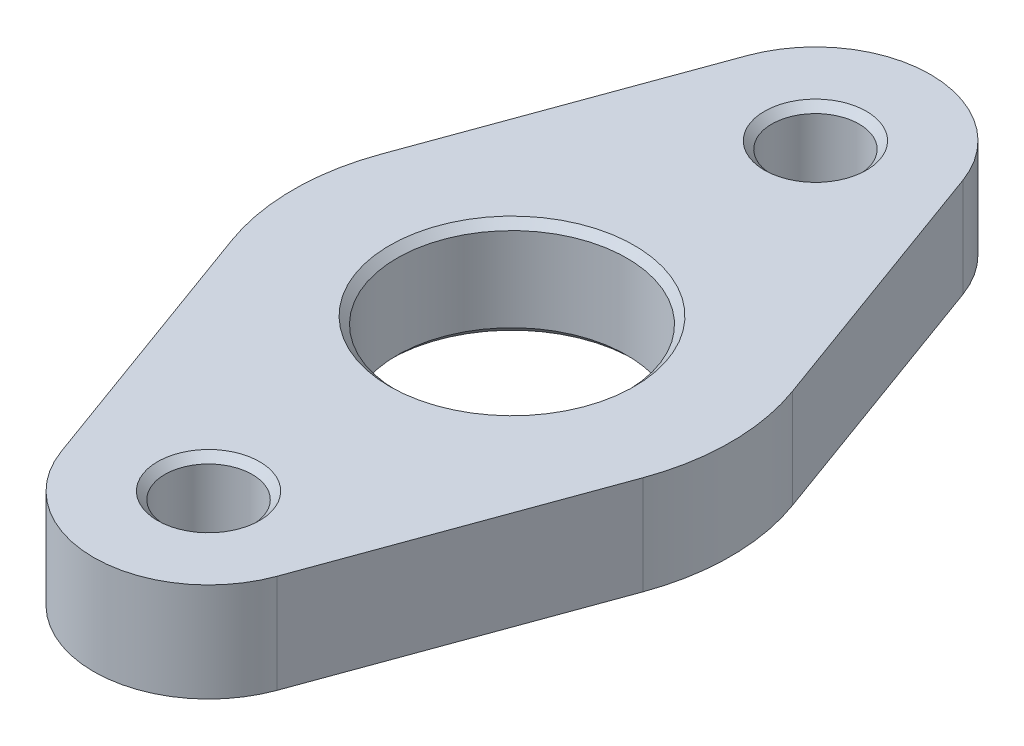
from build123d import *
from build123d.topology import SkipClean

# Parameters (mm, degrees)
BOSS_EXTRUDE1_START     = 16.51
SKETCH2_R               = 6.6675
SKETCH2_R_2             = 47.625
SKETCH2_R_3             = 25.4
BOSS_EXTRUDE1_DEPTH     = 16.51
CUT_EXTRUDE1_REACH      = 129.898
SKETCH3_R               = 9.525
CHAMFER1_SIZE           = 0.8128
CHAMFER2_SIZE           = 0.8128
CHAMFER3_SIZE           = 3.175
FILLET2_R               = 1.524
SKETCH4_R               = 7.4803
SKETCH4_R_2             = 25.4
BOSS_EXTRUDE2_DEPTH     = 16.51
SKETCH6_R               = 76.2
SKETCH6_R_2             = 9.525
SKETCH6_R_3             = 25.4
BOSS_EXTRUDE3_DEPTH     = 16.51
SKETCH8_R               = 12.7
SKETCH8_R_2             = 4.826
BOSS_EXTRUDE4_DEPTH     = 9.8552
BOSS_EXTRUDE5_REACH     = 241.142
SKETCH9_R               = 19.05
CUT_EXTRUDE2_REACH      = 241.142
CUT_EXTRUDE2_END_RADIUS = 25.4
SKETCH8_4_R             = 12.7
CHAMFER4_SIZE           = 0.8128
CHAMFER5_SIZE           = 3.175
FILLET3_R               = 2.032
SKETCH10_R              = 4.826
SKETCH10_R_2            = 12.7
BOSS_EXTRUDE6_DEPTH     = 10.922
CHAMFER6_SIZE           = 0.8128


with BuildPart() as part:
    # Sketch1 → Revolve1 (revolve)
    with BuildSketch(Plane.XY, mode=Mode.PRIVATE) as revolve1_sk:
        Polygon((0, 25.4), (53.975, 25.4), (53.975, 47.625), (52.3748, 46.0248), (52.3748, 34.29), (34.925, 34.29), (16.51, 38.204229083), (16.51, 76.2), (1.6002, 76.2), (1.6002, 47.6377), (0, 46.0375), align=None)
    revolve(revolve1_sk.sketch.rotate(Axis((0, 0, 0), (1, 0, 0)), 90), axis=Axis((0, 0, 0), (1, 0, 0)))

    # Sketch2 → Boss-Extrude1 (add)
    # profile 1 of 2: a face of its own
    with BuildSketch(Plane(origin=(53.975, 0, 0), x_dir=(0, 0, -1), z_dir=(1, 0, 0)).offset(BOSS_EXTRUDE1_START)):
        with BuildLine():
            Line((-59.9948, 40.005), (-59.9948, 24.717162721))
            ThreePointArc((-59.9948, 24.717162721), (-60.246417717, 21.150810443), (-60.996285714, 17.655116229))
            ThreePointArc((-60.996285714, 17.655116229), (-63.5, 0), (-60.996285714, -17.655116229))
            ThreePointArc((-60.996285714, -17.655116229), (-60.246417717, -21.150810443), (-59.9948, -24.717162721))
            Line((-59.9948, -24.717162721), (-59.9948, -40.005))
            ThreePointArc((-59.9948, -40.005), (-54.139923135, -54.139923135), (-40.005, -59.9948))
            Line((-40.005, -59.9948), (-24.717162721, -59.9948))
            ThreePointArc((-24.717162721, -59.9948), (-21.150810443, -60.246417717), (-17.655116229, -60.996285714))
            ThreePointArc((-17.655116229, -60.996285714), (0, -63.5), (17.655116229, -60.996285714))
            ThreePointArc((17.655116229, -60.996285714), (21.150810443, -60.246417717), (24.717162721, -59.9948))
            Line((24.717162721, -59.9948), (40.005, -59.9948))
            ThreePointArc((40.005, -59.9948), (54.139923135, -54.139923135), (59.9948, -40.005))
            Line((59.9948, -40.005), (59.9948, -24.717162721))
            ThreePointArc((59.9948, -24.717162721), (60.246417717, -21.150810443), (60.996285714, -17.655116229))
            ThreePointArc((60.996285714, -17.655116229), (63.5, 0), (60.996285714, 17.655116229))
            ThreePointArc((60.996285714, 17.655116229), (60.246417717, 21.150810443), (59.9948, 24.717162721))
            Line((59.9948, 24.717162721), (59.9948, 40.005))
            ThreePointArc((59.9948, 40.005), (54.139923135, 54.139923135), (40.005, 59.9948))
            Line((40.005, 59.9948), (24.717162721, 59.9948))
            ThreePointArc((24.717162721, 59.9948), (21.150810443, 60.246417717), (17.655116229, 60.996285714))
            ThreePointArc((17.655116229, 60.996285714), (0, 63.5), (-17.655116229, 60.996285714))
            ThreePointArc((-17.655116229, 60.996285714), (-21.150810443, 60.246417717), (-24.717162721, 59.9948))
            Line((-24.717162721, 59.9948), (-40.005, 59.9948))
            ThreePointArc((-40.005, 59.9948), (-54.139923135, 54.139923135), (-59.9948, 40.005))
        make_face()
        with Locations((-42.656216575, -42.656216575)):
            Circle(SKETCH2_R, mode=Mode.SUBTRACT)
        with Locations((42.656216575, -42.656216575)):
            Circle(SKETCH2_R, mode=Mode.SUBTRACT)
        with Locations((42.656216575, 42.656216575)):
            Circle(SKETCH2_R, mode=Mode.SUBTRACT)
        with Locations((-42.656216575, 42.656216575)):
            Circle(SKETCH2_R, mode=Mode.SUBTRACT)
        Circle(SKETCH2_R_2, mode=Mode.SUBTRACT)
    # profile 2 of 2: a face of its own
    with BuildSketch(Plane(origin=(53.975, 0, 0), x_dir=(0, 0, -1), z_dir=(1, 0, 0)).offset(BOSS_EXTRUDE1_START)):
        Circle(SKETCH2_R_2)
        with Locations(Location((0, 0, 0), (0, 0, 180))):
            Circle(SKETCH2_R_3, mode=Mode.SUBTRACT)
    extrude(amount=-BOSS_EXTRUDE1_DEPTH)

    # Sketch3 → Cut-Extrude1 (cut, up to next)
    with BuildSketch(Plane.ZY.offset(-1.6002), mode=Mode.PRIVATE) as cut_extrude1_sk1:
        with Locations((-42.656216575, 42.656216575)):
            Circle(SKETCH3_R)
    cut_extrude1_tool1 = extrude(cut_extrude1_sk1.sketch, amount=-CUT_EXTRUDE1_REACH, mode=Mode.PRIVATE) & part.part
    # Sketch3 → Cut-Extrude1 (cut, up to next)
    with BuildSketch(Plane.ZY.offset(-1.6002), mode=Mode.PRIVATE) as cut_extrude1_sk2:
        with Locations((42.656216575, 42.656216575)):
            Circle(SKETCH3_R)
    cut_extrude1_tool2 = extrude(cut_extrude1_sk2.sketch, amount=-CUT_EXTRUDE1_REACH, mode=Mode.PRIVATE) & part.part
    # Sketch3 → Cut-Extrude1 (cut, up to next)
    with BuildSketch(Plane.ZY.offset(-1.6002), mode=Mode.PRIVATE) as cut_extrude1_sk3:
        with Locations((42.656216575, -42.656216575)):
            Circle(SKETCH3_R)
    cut_extrude1_tool3 = extrude(cut_extrude1_sk3.sketch, amount=-CUT_EXTRUDE1_REACH, mode=Mode.PRIVATE) & part.part
    # Sketch3 → Cut-Extrude1 (cut, up to next)
    with BuildSketch(Plane.ZY.offset(-1.6002), mode=Mode.PRIVATE) as cut_extrude1_sk4:
        with Locations((-42.656216575, -42.656216575)):
            Circle(SKETCH3_R)
    cut_extrude1_tool4 = extrude(cut_extrude1_sk4.sketch, amount=-CUT_EXTRUDE1_REACH, mode=Mode.PRIVATE) & part.part
    add(cut_extrude1_tool1.solids().sort_by_distance((1.6002, 42.656217, -42.656217))[0], mode=Mode.SUBTRACT)
    add(cut_extrude1_tool2.solids().sort_by_distance((1.6002, 42.656217, 42.656217))[0], mode=Mode.SUBTRACT)
    add(cut_extrude1_tool3.solids().sort_by_distance((1.6002, -42.656217, 42.656217))[0], mode=Mode.SUBTRACT)
    add(cut_extrude1_tool4.solids().sort_by_distance((1.6002, -42.656217, -42.656217))[0], mode=Mode.SUBTRACT)

    # Chamfer1
    chamfer1_edges = [part.edges().sort_by_distance(p)[0] for p in [
        (70.485, 42.656216575, 49.323716575),
        (70.485, 42.656216575, -35.988716575),
        (70.485, -42.656216575, -35.988716575),
        (70.485, -42.656216575, 49.323716575),
        (53.975, -42.656216575, 49.323716575),
        (53.975, -42.656216575, -35.988716575),
        (53.975, 42.656216575, -35.988716575),
        (53.975, 42.656216575, 49.323716575),
    ]]
    chamfer(chamfer1_edges, length=CHAMFER1_SIZE)

    # Chamfer2
    chamfer2_edges = [part.edges().sort_by_distance(p)[0] for p in [
        (1.6002, -42.656216575, 33.131216575),
        (16.51, -42.656216575, 33.131216575),
        (1.6002, 42.656216575, 33.131216575),
        (16.51, 42.656216575, 33.131216575),
        (1.6002, 42.656216575, -52.181216575),
        (16.51, 42.656216575, -52.181216575),
        (1.6002, -42.656216575, -52.181216575),
        (16.51, -42.656216575, -52.181216575),
    ]]
    chamfer(chamfer2_edges, length=CHAMFER2_SIZE)

    # Chamfer3
    chamfer3_edges = [part.edges().sort_by_distance(p)[0] for p in [
        (0, 0, -25.4),
        (70.485, 0, -25.4),
    ]]
    chamfer(chamfer3_edges, length=CHAMFER3_SIZE)

    # Fillet2
    fillet2_edges = [part.edges().sort_by_distance(p)[0] for p in [
        (16.51, 0, -38.204229083),
        (52.3748, 0, -34.29),
    ]]
    fillet(fillet2_edges, radius=FILLET2_R)


with BuildPart() as body_2:
    # Sketch4 → Boss-Extrude2 (new body)
    with BuildSketch(Plane(origin=(70.485, 0, 0), x_dir=(0, 0, -1), z_dir=(1, 0, 0))):
        with BuildLine():
            Line((-59.9948, 40.005), (-59.9948, 24.717162721))
            ThreePointArc((-59.9948, 24.717162721), (-60.246417717, 21.150810443), (-60.996285714, 17.655116229))
            ThreePointArc((-60.996285714, 17.655116229), (-63.5, 0), (-60.996285714, -17.655116229))
            ThreePointArc((-60.996285714, -17.655116229), (-60.246417717, -21.150810443), (-59.9948, -24.717162721))
            Line((-59.9948, -24.717162721), (-59.9948, -40.005))
            ThreePointArc((-59.9948, -40.005), (-54.139923135, -54.139923135), (-40.005, -59.9948))
            Line((-40.005, -59.9948), (-24.717162721, -59.9948))
            ThreePointArc((-24.717162721, -59.9948), (-21.150810443, -60.246417717), (-17.655116229, -60.996285714))
            ThreePointArc((-17.655116229, -60.996285714), (0, -63.5), (17.655116229, -60.996285714))
            ThreePointArc((17.655116229, -60.996285714), (21.150810443, -60.246417717), (24.717162721, -59.9948))
            Line((24.717162721, -59.9948), (40.005, -59.9948))
            ThreePointArc((40.005, -59.9948), (54.139923135, -54.139923135), (59.9948, -40.005))
            Line((59.9948, -40.005), (59.9948, -24.717162721))
            ThreePointArc((59.9948, -24.717162721), (60.246417717, -21.150810443), (60.996285714, -17.655116229))
            ThreePointArc((60.996285714, -17.655116229), (63.5, 0), (60.996285714, 17.655116229))
            ThreePointArc((60.996285714, 17.655116229), (60.246417717, 21.150810443), (59.9948, 24.717162721))
            Line((59.9948, 24.717162721), (59.9948, 40.005))
            ThreePointArc((59.9948, 40.005), (54.139923135, 54.139923135), (40.005, 59.9948))
            Line((40.005, 59.9948), (24.717162721, 59.9948))
            ThreePointArc((24.717162721, 59.9948), (21.150810443, 60.246417717), (17.655116229, 60.996285714))
            ThreePointArc((17.655116229, 60.996285714), (0, 63.5), (-17.655116229, 60.996285714))
            ThreePointArc((-17.655116229, 60.996285714), (-21.150810443, 60.246417717), (-24.717162721, 59.9948))
            Line((-24.717162721, 59.9948), (-40.005, 59.9948))
            ThreePointArc((-40.005, 59.9948), (-54.139923135, 54.139923135), (-59.9948, 40.005))
        make_face()
        with Locations((42.656216575, -42.656216575)):
            Circle(SKETCH4_R, mode=Mode.SUBTRACT)
        with Locations((42.656216575, 42.656216575)):
            Circle(SKETCH4_R, mode=Mode.SUBTRACT)
        with Locations((-42.656216575, 42.656216575)):
            Circle(SKETCH4_R, mode=Mode.SUBTRACT)
        with Locations((-42.656216575, -42.656216575)):
            Circle(SKETCH4_R, mode=Mode.SUBTRACT)
        Circle(SKETCH4_R_2, mode=Mode.SUBTRACT)
    extrude(amount=BOSS_EXTRUDE2_DEPTH)

    # Sketch5 → Revolve2 (revolve)
    with BuildSketch(Plane.XY, mode=Mode.PRIVATE) as revolve2_sk:
        with BuildLine():
            Line((86.995, -25.4), (156.845, -25.4))
            Line((156.845, -25.4), (156.845, -38.1))
            Line((156.845, -38.1), (141.097, -38.1))
            Line((141.097, -38.1), (100.143007491, -49.07358922))
            ThreePointArc((100.143007491, -49.07358922), (93.625730565, -50.369956202), (86.995, -50.804557244))
            Line((86.995, -50.804557244), (86.995, -25.4))
        make_face()
    revolve(revolve2_sk.sketch.rotate(Axis((0, 0, 0), (1, 0, 0)), 270), axis=Axis((0, 0, 0), (1, 0, 0)))

    # Sketch6 → Boss-Extrude3 (add)
    with BuildSketch(Plane(origin=(156.845, 0, 0), x_dir=(0, 0, -1), z_dir=(1, 0, 0))):
        Circle(SKETCH6_R)
        with Locations((-42.656216575, 42.656216575)):
            Circle(SKETCH6_R_2, mode=Mode.SUBTRACT)
        with Locations((-42.656216575, -42.656216575)):
            Circle(SKETCH6_R_2, mode=Mode.SUBTRACT)
        with Locations((42.656216575, 42.656216575)):
            Circle(SKETCH6_R_2, mode=Mode.SUBTRACT)
        with Locations((42.656216575, -42.656216575)):
            Circle(SKETCH6_R_2, mode=Mode.SUBTRACT)
        Circle(SKETCH6_R_3, mode=Mode.SUBTRACT)
    extrude(amount=BOSS_EXTRUDE3_DEPTH)

    # Sketch8 → Boss-Extrude4 (add)
    # profile 1 of 4: a face of its own
    with BuildSketch(Plane(origin=(0, 69.85, 0), x_dir=(1, 0, 0), z_dir=(0, 1, 0))):
        with Locations((95.885, 33.528)):
            Circle(SKETCH8_R)
        with Locations(Location((95.885, 33.528, 0), (0, 0, 270))):
            Circle(SKETCH8_R_2, mode=Mode.SUBTRACT)
    # profile 2 of 4: a face of its own
    with BuildSketch(Plane(origin=(0, 69.85, 0), x_dir=(1, 0, 0), z_dir=(0, 1, 0))):
        with BuildLine():
            ThreePointArc((108.585, 33.528), (93.679668144, 21.020941537), (83.950903716, 37.87165582))
            Line((83.950903716, 37.87165582), (73.170574985, 8.252946058))
            ThreePointArc((73.170574985, 8.252946058), (71.715357925, 0), (73.170574985, -8.252946058))
            Line((73.170574985, -8.252946058), (83.950903716, -37.87165582))
            ThreePointArc((83.950903716, -37.87165582), (93.679668144, -21.020941537), (108.585, -33.528))
            ThreePointArc((108.585, -33.528), (108.392058463, -35.733331856), (107.819096284, -37.87165582))
            Line((107.819096284, -37.87165582), (118.599425015, -8.252946058))
            ThreePointArc((118.599425015, -8.252946058), (120.054642075, 0), (118.599425015, 8.252946058))
            Line((118.599425015, 8.252946058), (107.819096284, 37.87165582))
            ThreePointArc((107.819096284, 37.87165582), (108.392058463, 35.733331856), (108.585, 33.528))
        make_face()
        with Locations((95.885, 0)):
            Circle(SKETCH8_R, mode=Mode.SUBTRACT)
    # profile 3 of 4: a face of its own
    with BuildSketch(Plane(origin=(0, 69.85, 0), x_dir=(1, 0, 0), z_dir=(0, 1, 0))):
        with Locations((95.885, -33.528)):
            Circle(SKETCH8_R)
        with Locations(Location((95.885, -33.528, 0), (0, 0, 270))):
            Circle(SKETCH8_R_2, mode=Mode.SUBTRACT)
    # profile 4 of 4: a face of its own
    with BuildSketch(Plane(origin=(0, 69.85, 0), x_dir=(1, 0, 0), z_dir=(0, 1, 0))):
        with Locations((95.885, 0)):
            Circle(SKETCH8_R)
    extrude(amount=-BOSS_EXTRUDE4_DEPTH)

    # Sketch9 → Boss-Extrude5 (add, up to next)
    with BuildSketch(Plane(origin=(0, 69.85, 0), x_dir=(1, 0, 0), z_dir=(0, 1, 0)), mode=Mode.PRIVATE) as boss_extrude5_sk1:
        with Locations((95.924642075, 0)):
            Circle(SKETCH9_R)
    boss_extrude5_tool1 = extrude(boss_extrude5_sk1.sketch, amount=-BOSS_EXTRUDE5_REACH, mode=Mode.PRIVATE) - body_2.part
    add(boss_extrude5_tool1.solids().sort_by_distance((95.924642, 69.85, 0))[0])

    # Cut-Extrude2: up to this cylinder (the profile starts outside it)
    with SkipClean():  # the faces are left unmerged after this step: merging them gives an invalid solid
        cut_extrude2_end = Plane(origin=(95.885, 0, 0), z_dir=(-1, 0, 0)) * Cylinder(CUT_EXTRUDE2_END_RADIUS, 534.084, mode=Mode.PRIVATE)
        # Sketch8<4> → Cut-Extrude2 (cut, up to the surface)
        with BuildSketch(Plane(origin=(0, 69.85, 0), x_dir=(1, 0, 0), z_dir=(0, 1, 0)), mode=Mode.PRIVATE) as cut_extrude2_sk1:
            with Locations(Location((95.885, 0, 0), (0, 0, 270))):
                Circle(SKETCH8_4_R)
        cut_extrude2_tool1 = extrude(cut_extrude2_sk1.sketch, amount=-CUT_EXTRUDE2_REACH, mode=Mode.PRIVATE) - cut_extrude2_end
        add(cut_extrude2_tool1.solids().sort_by_distance((95.885, 69.85, 0))[0], mode=Mode.SUBTRACT)

    # Chamfer4
    chamfer4_edges = [body_2.edges().sort_by_distance(p)[0] for p in [
        (86.995, 42.656216575, -35.175916575),
        (173.355, 0, 76.2),
        (156.845, 42.656216575, -33.131216575),
        (156.845, -42.656216575, -33.131216575),
        (156.845, -42.656216575, 52.181216575),
        (156.845, 42.656216575, 52.181216575),
        (156.845, 0, 76.2),
        (173.355, 42.656216575, -33.131216575),
        (173.355, -42.656216575, -33.131216575),
        (173.355, -42.656216575, 52.181216575),
        (173.355, 42.656216575, 52.181216575),
        (86.995, -42.656216575, 50.136516575),
        (95.885, 69.85, -38.354),
        (95.885, 59.9948, 28.702),
        (86.995, 42.656216575, 50.136516575),
        (95.885, 69.85, 28.702),
        (86.995, -42.656216575, -35.175916575),
        (95.885, 69.85, -12.7),
        (70.485, -42.656216575, -35.175916575),
        (70.485, 42.656216575, 50.136516575),
        (70.485, -42.656216575, 50.136516575),
        (70.485, 42.656216575, -35.175916575),
    ]]
    chamfer(chamfer4_edges, length=CHAMFER4_SIZE)

    # Chamfer5
    chamfer5_edges = [body_2.edges().sort_by_distance(p)[0] for p in [
        (173.355, 0, 25.4),
        (70.485, 0, 25.4),
    ]]
    chamfer(chamfer5_edges, length=CHAMFER5_SIZE)

    # Fillet3
    fillet3_edges = [body_2.edges().sort_by_distance(p)[0] for p in [
        (141.097, 0, -38.1),
        (156.845, 0, -38.1),
        (86.995, -41.448857468, -29.378482796),
        (93.420094709, 46.72459453, 18.884643029),
        (114.974642075, 45.09946471, 0),
        (93.420094709, 46.72459453, -18.884643029),
    ]]
    fillet(fillet3_edges, radius=FILLET3_R)


with BuildPart() as body_2_2:
    # Sketch10 → Boss-Extrude6 (new body)
    with BuildSketch(Plane(origin=(0, 69.85, 0), x_dir=(1, 0, 0), z_dir=(0, 1, 0))):
        with BuildLine():
            Line((83.950903716, 37.87165582), (73.170574985, 8.252946058))
            ThreePointArc((73.170574985, 8.252946058), (71.715357925, 0), (73.170574985, -8.252946058))
            Line((73.170574985, -8.252946058), (83.950903716, -37.87165582))
            ThreePointArc((83.950903716, -37.87165582), (95.885, -46.228), (107.819096284, -37.87165582))
            Line((107.819096284, -37.87165582), (118.599425015, -8.252946058))
            ThreePointArc((118.599425015, -8.252946058), (120.054642075, 0), (118.599425015, 8.252946058))
            Line((118.599425015, 8.252946058), (107.819096284, 37.87165582))
            ThreePointArc((107.819096284, 37.87165582), (95.885, 46.228), (83.950903716, 37.87165582))
        make_face()
        with Locations(Location((95.885, 33.528, 0), (0, 0, 270))):
            Circle(SKETCH10_R, mode=Mode.SUBTRACT)
        with Locations(Location((95.885, -33.528, 0), (0, 0, 270))):
            Circle(SKETCH10_R, mode=Mode.SUBTRACT)
        with Locations(Location((95.885, 0, 0), (0, 0, 270))):
            Circle(SKETCH10_R_2, mode=Mode.SUBTRACT)
    extrude(amount=BOSS_EXTRUDE6_DEPTH)

    # Chamfer6
    chamfer6_edges = [body_2_2.edges().sort_by_distance(p)[0] for p in [
        (95.885, 69.85, -38.354),
        (95.885, 80.772, -38.354),
        (95.885, 69.85, 28.702),
        (95.885, 80.772, 28.702),
        (95.885, 69.85, -12.7),
        (95.885, 80.772, -12.7),
    ]]
    chamfer(chamfer6_edges, length=CHAMFER6_SIZE)


solid = body_2_2.part
